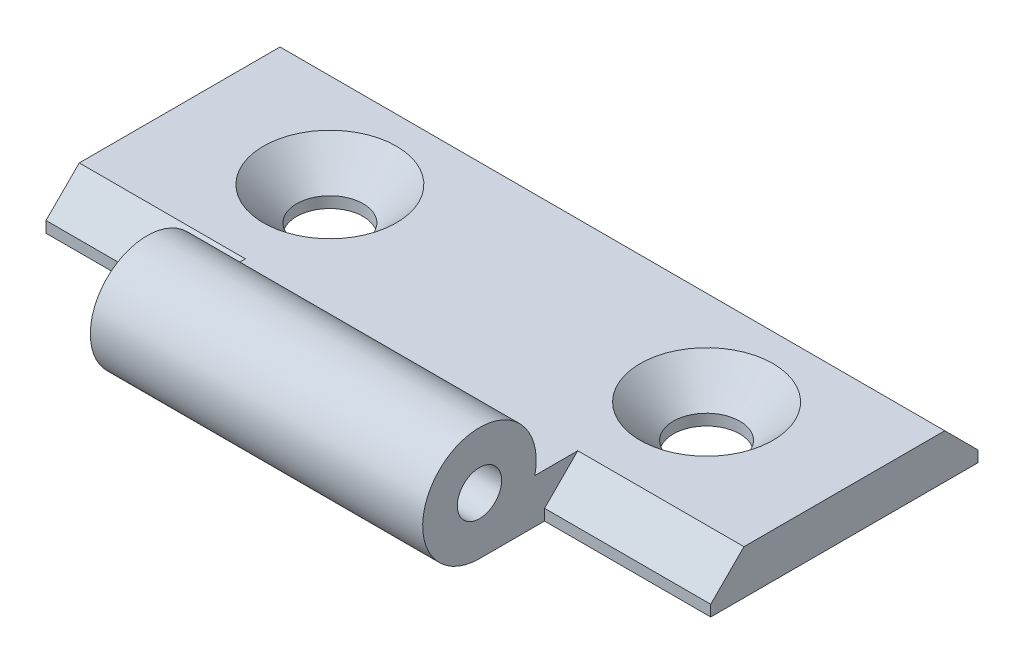
from build123d import *

# Parameters (mm, degrees)
SKETCH_1_R          = 2
EXTRUDE_1_DEPTH     = 30
SKETCH_2_R          = 3
SKETCH_2_W          = 15
SKETCH_2_H          = 11
CUT_EXTRUDE_1_DEPTH = 44.647021662
CHAMFER_1_SIZE      = 3


with BuildPart() as part:
    # 草图1 → 凸台-拉伸1 (new, symmetric)
    with BuildSketch(Plane(origin=(0, 0, 0), x_dir=(0, 0, -1), z_dir=(1, 0, 0))):
        with BuildLine():
            Line((0, 0), (30, 0))
            Line((30, 0), (30, 4))
            Line((30, 4), (5, 4))
            ThreePointArc((5, 4), (-3.201562119, 9.126952648), (0, 0))
        make_face()
        with Locations((0, 5.125)):
            Circle(SKETCH_1_R, mode=Mode.SUBTRACT)
    extrude(amount=EXTRUDE_1_DEPTH, both=True)

    # 草图2 → 切除-拉伸1 (cut, through all)
    with BuildSketch(Plane(origin=(0, 0, 0), x_dir=(1, 0, 0), z_dir=(0, 1, 0))):
        with Locations(Location((-17, 18.5, 0), (0, 0, 90))):
            Circle(SKETCH_2_R)
        with Locations(Location((17, 18.5, 0), (0, 0, 90))):
            Circle(SKETCH_2_R)
        with Locations((22.5, 0.375)):
            Rectangle(SKETCH_2_W, SKETCH_2_H)
        with Locations((-22.5, 0.375)):
            Rectangle(SKETCH_2_W, SKETCH_2_H)
    extrude(amount=CUT_EXTRUDE_1_DEPTH, mode=Mode.SUBTRACT)

    # 倒角1
    chamfer_1_edges = [part.edges().sort_by_distance(p)[0] for p in [
        (22.5, 4, -5.875),
        (-22.5, 4, -5.875),
        (17, 4, -15.5),
        (-17, 4, -15.5),
        (0, 4, -30),
    ]]
    chamfer(chamfer_1_edges, length=CHAMFER_1_SIZE)


solid = part.part
